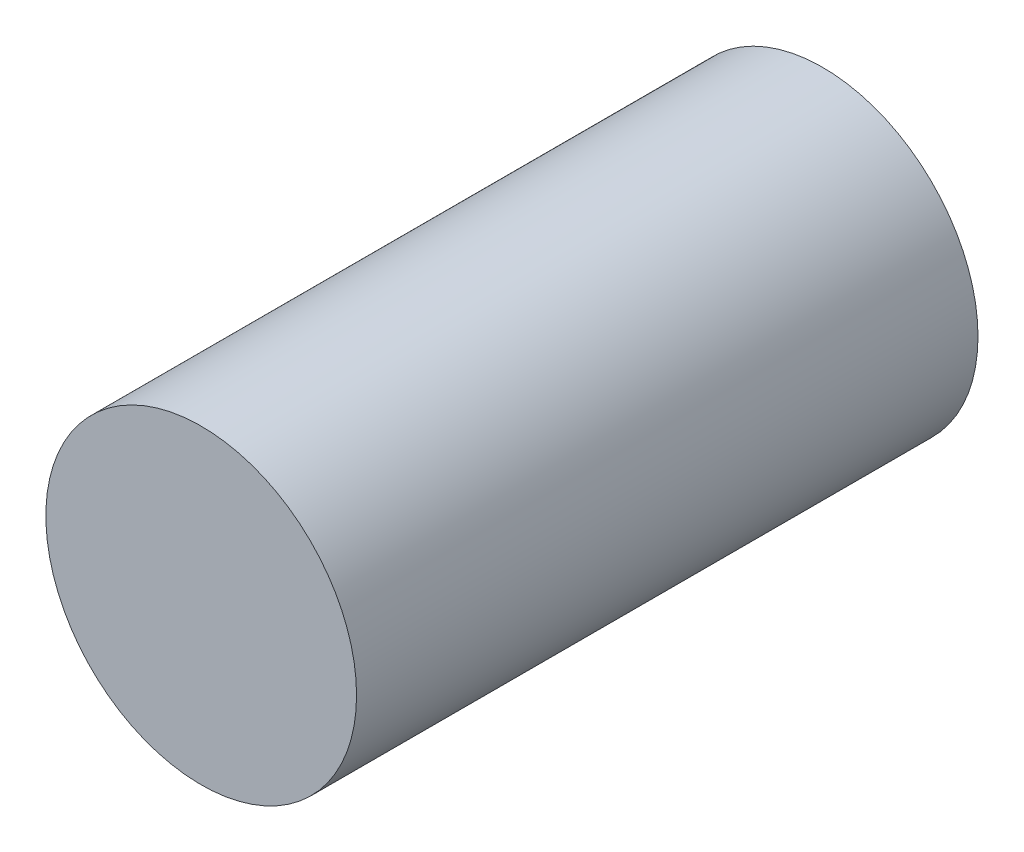
from build123d import *

# Parameters (mm, degrees)
SKETCH1_R           = 6.35
BOSS_EXTRUDE1_DEPTH = 25.4


with BuildPart() as part:
    # Sketch1 → Boss-Extrude1 (new body)
    with BuildSketch(Plane.XY):
        Circle(SKETCH1_R)
    extrude(amount=BOSS_EXTRUDE1_DEPTH)


solid = part.part
